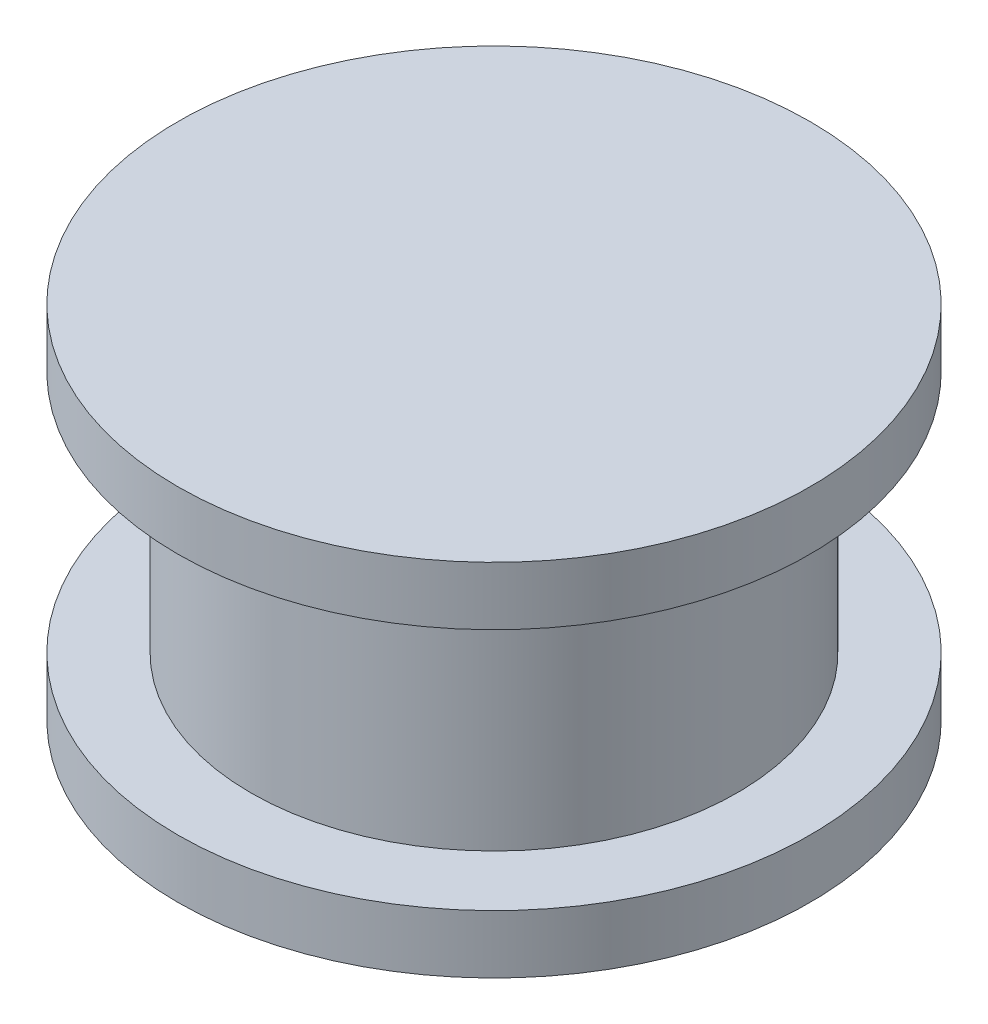
from build123d import *

# Parameters (mm, degrees)
SKETCH1_R           = 5
BOSS_EXTRUDE1_DEPTH = 5
SKETCH2_R           = 6.5
BOSS_EXTRUDE2_DEPTH = 1.2
BOSS_EXTRUDE3_START = 1.2
SKETCH3_R           = 6.5
BOSS_EXTRUDE3_DEPTH = 1.2


with BuildPart() as part:
    # Sketch1 → Boss-Extrude1 (new body)
    with BuildSketch(Plane(origin=(0, 0, 0), x_dir=(1, 0, 0), z_dir=(0, 1, 0))):
        with Locations(Location((0, 0, 0), (0, 0, 270))):
            Circle(SKETCH1_R)
    extrude(amount=BOSS_EXTRUDE1_DEPTH)

    # Sketch2 → Boss-Extrude2 (add)
    with BuildSketch(Plane(origin=(0, 5, 0), x_dir=(1, 0, 0), z_dir=(0, 1, 0))):
        with Locations(Location((0, 0, 0), (0, 0, 270))):
            Circle(SKETCH2_R)
    extrude(amount=BOSS_EXTRUDE2_DEPTH)

    # Sketch3 → Boss-Extrude3 (add)
    with BuildSketch(Plane.XZ.offset(BOSS_EXTRUDE3_START)):
        with Locations(Location((0, 0, 0), (0, 0, 90))):
            Circle(SKETCH3_R)
    extrude(amount=-BOSS_EXTRUDE3_DEPTH)


solid = part.part
